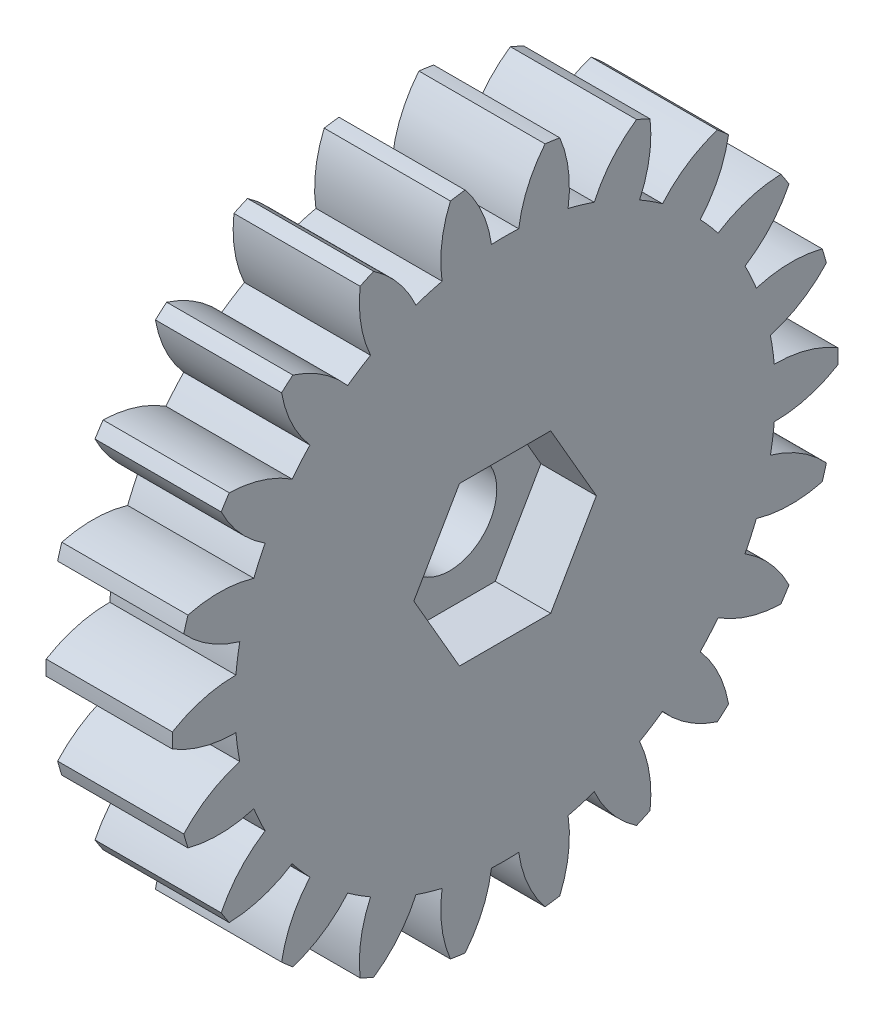
from build123d import *

# Parameters (mm, degrees)
BASPROSKE_W         = 4.55
BASPROSKE_H         = 12
TOOTHCUT_DEPTH      = 18.569931702
TEETHCUTS_COUNT     = 22
TEETHCUTS_ANGLE     = 343.636363636
BORSKE_R            = 1.7
BORE_DEPTH          = 50.0000508
SKETCH1_R           = 5
BOSS_EXTRUDE1_DEPTH = 2
CUT_EXTRUDE1_START  = 2
SKETCH1_2_W         = 5
SKETCH1_2_H         = 5
CUT_EXTRUDE1_DEPTH  = 2.55
SKETCH1_4_R         = 6
SKETCH1_4_R_2       = 5
BOSS_EXTRUDE2_DEPTH = 1
CUT_EXTRUDE2_DEPTH  = 2


with BuildPart() as part:
    # BasProSke → Base-Revolve (revolve)
    with BuildSketch(Plane(origin=(0, 0, 0), x_dir=(1, 0, 0), z_dir=(0, 1, 0)), mode=Mode.PRIVATE) as base_revolve_sk:
        with Locations((2.275, 6)):
            Rectangle(BASPROSKE_W, BASPROSKE_H)
    revolve(base_revolve_sk.sketch.rotate(Axis((-10, 0, 0), (1, 0, 0)), 180), axis=Axis((-10, 0, 0), (1, 0, 0)))

    # TooCutSke → ToothCut (cut, through all)
    with BuildSketch(Plane(origin=(0, 0, 0), x_dir=(0, 0, -1), z_dir=(1, 0, 0))):
        with BuildLine():
            ThreePointArc((0.491001901, 9.736627657), (0, 9.749), (-0.491001901, 9.736627657))
            ThreePointArc((-0.491001901, 9.736627657), (-0.822824844, 10.904005344), (-1.46093845, 11.936327074))
            ThreePointArc((-1.46093845, 11.936327074), (0, 12.0254), (1.46093845, 11.936327074))
            ThreePointArc((1.46093845, 11.936327074), (0.822824844, 10.904005344), (0.491001901, 9.736627657))
        make_face()
    toothcut = extrude(amount=TOOTHCUT_DEPTH, mode=Mode.SUBTRACT)

    # TeethCuts: ToothCut ×22 about axis
    teethcuts_axis = Axis((-10, 0, 0), (1, 0, 0))
    for i in range(1, TEETHCUTS_COUNT):
        add(toothcut.rotate(teethcuts_axis, i * TEETHCUTS_ANGLE / (TEETHCUTS_COUNT - 1)), mode=Mode.SUBTRACT)

    # BorSke → Bore (cut, symmetric)
    with BuildSketch(Plane(origin=(0, 0, 0), x_dir=(0, 0, -1), z_dir=(1, 0, 0))):
        with Locations(Location((0, 0, 0), (0, 0, 180))):
            Circle(BORSKE_R)
    extrude(amount=BORE_DEPTH, both=True, mode=Mode.SUBTRACT)

    # Sketch1 → Boss-Extrude1 (add)
    with BuildSketch(Plane.ZY):
        with Locations(Location((0, 0, 0), (0, 0, 180))):
            Circle(SKETCH1_R)
    extrude(amount=BOSS_EXTRUDE1_DEPTH)

    # Sketch1<2> → Cut-Extrude1 (cut)
    with BuildSketch(Plane.ZY.offset(CUT_EXTRUDE1_START)):
        Rectangle(SKETCH1_2_W, SKETCH1_2_H)
    extrude(amount=-CUT_EXTRUDE1_DEPTH, mode=Mode.SUBTRACT)

    # Sketch1<4> → Boss-Extrude2 (add)
    with BuildSketch(Plane.ZY):
        with Locations(Location((0, 0, 0), (0, 0, 180))):
            Circle(SKETCH1_4_R)
        Circle(SKETCH1_4_R_2, mode=Mode.SUBTRACT)
    extrude(amount=BOSS_EXTRUDE2_DEPTH)

    # Sketch2 → Cut-Extrude2 (cut)
    with BuildSketch(Plane(origin=(4.55, 0, 0), x_dir=(0, 0, -1), z_dir=(1, 0, 0))):
        Polygon((1.645448267, 2.85), (-1.645448267, 2.85), (-3.290896534, 0), (-1.645448267, -2.85), (1.645448267, -2.85), (3.290896534, 0), align=None)
    extrude(amount=-CUT_EXTRUDE2_DEPTH, mode=Mode.SUBTRACT)


solid = part.part
